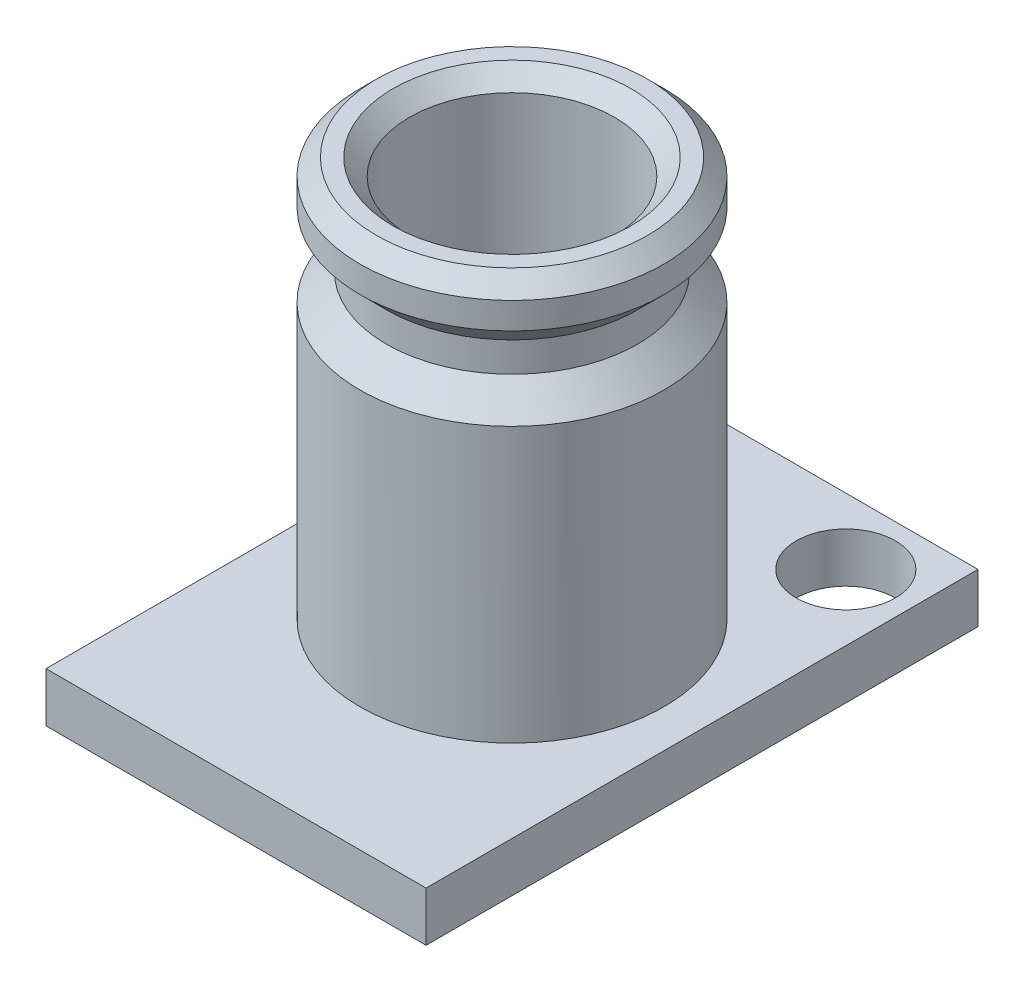
from build123d import *

# Parameters (mm, degrees)
SKETCH1_W           = 11.5
SKETCH1_H           = 16.7
BOSS_EXTRUDE1_DEPTH = 1.5
SKETCH5_R           = 1.5
CUT_EXTRUDE2_DEPTH  = 11.248658449
SKETCH2_R           = 4.6
BOSS_EXTRUDE2_DEPTH = 12.1
CHAMFER1_SIZE       = 0.5
SKETCH4_R           = 3.1
CUT_EXTRUDE1_DEPTH  = 8
CHAMFER2_SIZE       = 0.5


with BuildPart() as part:
    # Sketch1 → Boss-Extrude1 (new body)
    with BuildSketch(Plane(origin=(0, 0, 0), x_dir=(1, 0, 0), z_dir=(0, 1, 0))):
        Rectangle(SKETCH1_W, SKETCH1_H)
    extrude(amount=BOSS_EXTRUDE1_DEPTH)

    # Sketch5 → Cut-Extrude2 (cut, through all)
    with BuildSketch(Plane(origin=(0, 1.5, 0), x_dir=(1, 0, 0), z_dir=(0, 1, 0))):
        with Locations(Location((-3.75, 6.35, 0), (0, 0, 270))):
            Circle(SKETCH5_R)
    cut_extrude2 = extrude(amount=-CUT_EXTRUDE2_DEPTH, mode=Mode.SUBTRACT)

    # Mirror1: Cut-Extrude2 across plane
    add(cut_extrude2.mirror(Plane(origin=(0, 0, 0), x_dir=(0, 0, 1), z_dir=(1, 0, 0))), mode=Mode.SUBTRACT)


with BuildPart() as body_2:
    # Sketch2 → Boss-Extrude2 (new body)
    with BuildSketch(Plane(origin=(0, 1.5, 0), x_dir=(1, 0, 0), z_dir=(0, 1, 0))):
        with Locations(Location((0, 0, 0), (0, 0, 270))):
            Circle(SKETCH2_R)
    extrude(amount=BOSS_EXTRUDE2_DEPTH)

    # Chamfer1
    chamfer1_edges = [body_2.edges().sort_by_distance(p)[0] for p in [
        (0, 13.6, -4.6),
    ]]
    chamfer(chamfer1_edges, length=CHAMFER1_SIZE)

    # Sketch3 → Cut-Revolve1 (revolve, cut)
    with BuildSketch(Plane(origin=(0, 0, 0), x_dir=(0, 0, -1), z_dir=(1, 0, 0))):
        Polygon((4.6, 12.3), (3.8, 11.5), (3.8, 10.6), (4.6, 9.8), align=None)
    revolve(axis=Axis((0, -1000, 0), (0, 1, 0)), mode=Mode.SUBTRACT)

    # Sketch4 → Cut-Extrude1 (cut)
    with BuildSketch(Plane(origin=(0, 13.6, 0), x_dir=(1, 0, 0), z_dir=(0, 1, 0))):
        with Locations(Location((0, 0, 0), (0, 0, 270))):
            Circle(SKETCH4_R)
    extrude(amount=-CUT_EXTRUDE1_DEPTH, mode=Mode.SUBTRACT)

    # Chamfer2
    chamfer2_edges = [body_2.edges().sort_by_distance(p)[0] for p in [
        (0, 13.6, -3.1),
    ]]
    chamfer(chamfer2_edges, length=CHAMFER2_SIZE)


solid = Compound([part.part, body_2.part])
